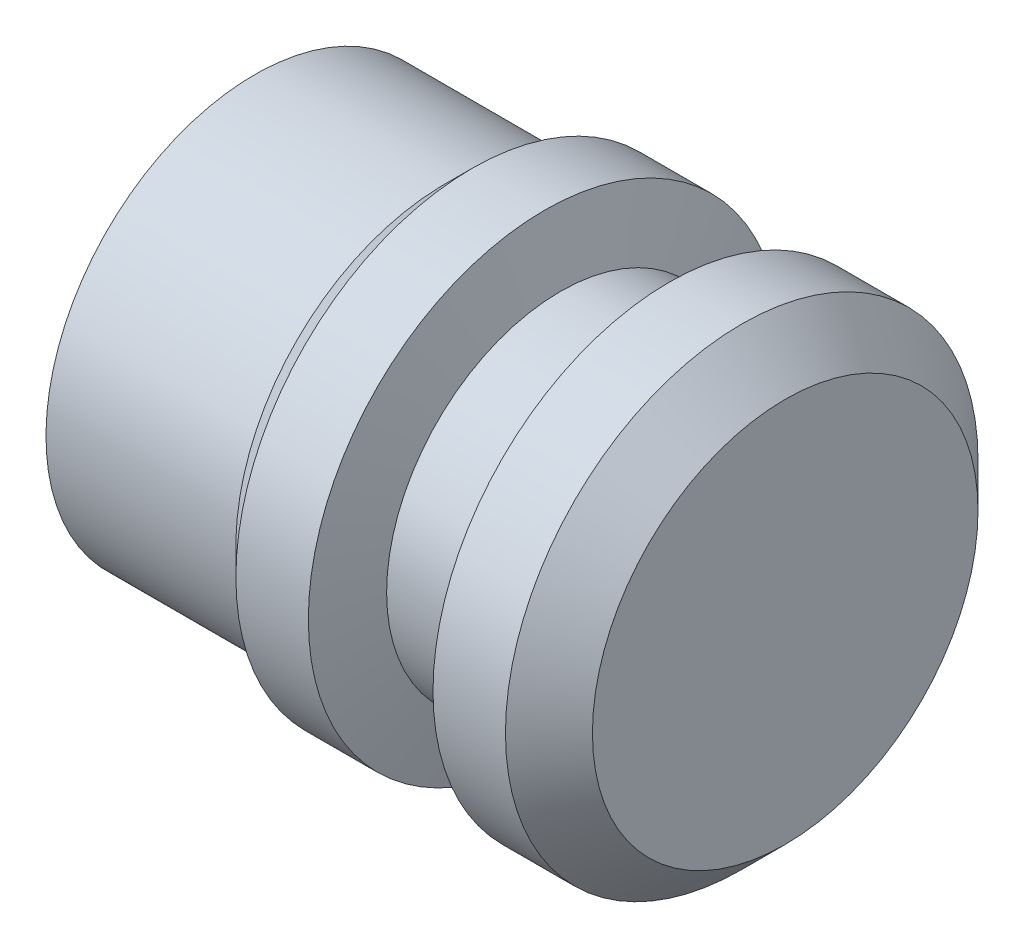
from build123d import *

# Parameters (mm, degrees)
CHAMFER1_SIZE            = 0.75
BOSS_EXTRUDE1_DEPTH      = 3
BOSS_EXTRUDE1_DEPTH_BACK = 1
SKETCH2_R                = 3.6
SKETCH3_R                = 0.55
BOSS_EXTRUDE2_DEPTH      = 2
CUT_EXTRUDE1_DEPTH       = 2.5


with BuildPart() as part:
    # Sketch1 → Revolve1 (revolve)
    with BuildSketch(Plane(origin=(0, 0, 0), x_dir=(1, 0, 0), z_dir=(0, 1, 0)), mode=Mode.PRIVATE) as revolve1_sk:
        Polygon((-4.15, 4.075), (-6.15, 4.075), (-6.15, 0), (0, 0), (0, 4.075), (-2, 4.075), (-2.275, 3), (-3.875, 3), align=None)
    revolve(revolve1_sk.sketch.rotate(Axis((-23.01300908, 0, 0), (1, 0, 0)), 180), axis=Axis((-23.01300908, 0, 0), (1, 0, 0)))

    # Chamfer1
    chamfer1_edges = [part.edges().sort_by_distance(p)[0] for p in [
        (-6.15, 0, -4.075),
        (0, 0, -4.075),
    ]]
    chamfer(chamfer1_edges, length=CHAMFER1_SIZE)

    # Sketch2 → Boss-Extrude1 (add, two sides: drawn at the far end of the back side and taken through both)
    with BuildSketch(Plane.ZY.offset(6.15).offset(-BOSS_EXTRUDE1_DEPTH_BACK)):
        Circle(SKETCH2_R)
    extrude(amount=BOSS_EXTRUDE1_DEPTH + BOSS_EXTRUDE1_DEPTH_BACK)

    # Sketch3 → Boss-Extrude2 (add)
    with BuildSketch(Plane.ZY.offset(9.15)):
        Circle(SKETCH3_R)
    extrude(amount=BOSS_EXTRUDE2_DEPTH)

    # Sketch4 → Cut-Extrude1 (cut)
    with BuildSketch(Plane.ZY.offset(9.15)):
        with BuildLine():
            Line((0, -3.6), (0, -2.05))
            ThreePointArc((0, -2.05), (-1.081944444, -1.741234108), (-1.837969336, -0.907947531))
            Line((-1.837969336, -0.907947531), (-3.227653469, -1.594444444))
            ThreePointArc((-3.227653469, -1.594444444), (-1.9, -3.05777697), (0, -3.6))
        make_face()
    extrude(amount=-CUT_EXTRUDE1_DEPTH, mode=Mode.SUBTRACT)


solid = part.part
